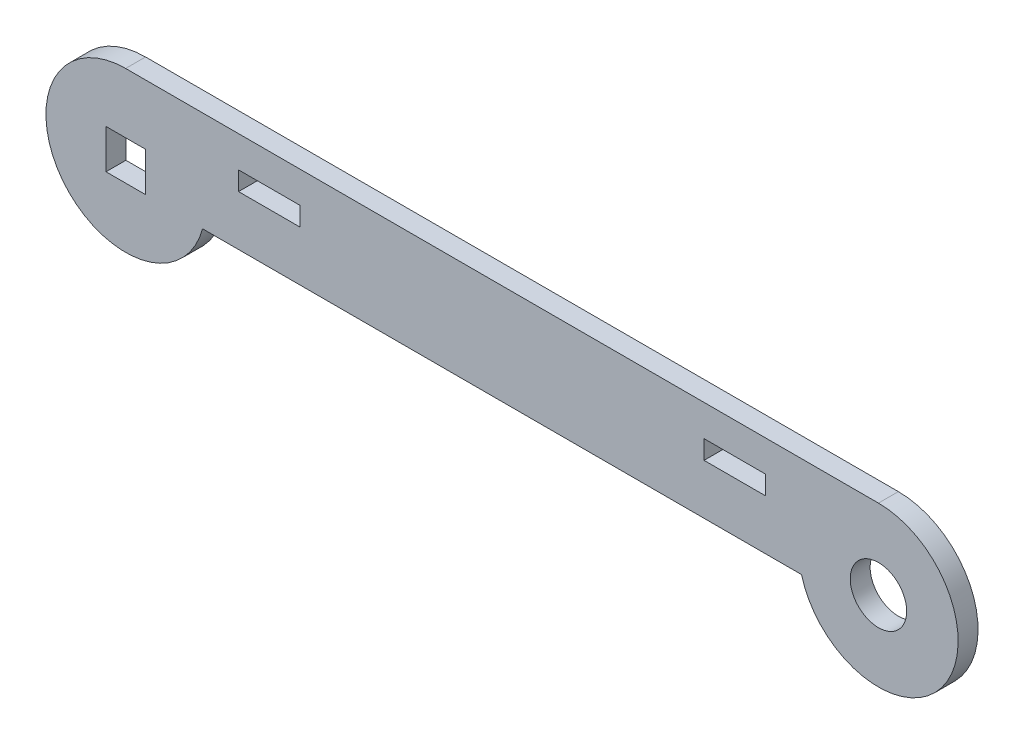
from build123d import *

# Parameters (mm, degrees)
SKETCH1_W           = 4.9
SKETCH1_H           = 1.5
SKETCH1_R           = 6.35
SKETCH1_W_2         = 3.13
SKETCH1_H_2         = 3.13
SKETCH1_R_2         = 2.25
BOSS_EXTRUDE1_DEPTH = 1.5875


with BuildPart() as part:
    # Sketch1 → Boss-Extrude1 (new body)
    # profile 1 of 3: a face of its own
    with BuildSketch(Plane.XY):
        with BuildLine():
            Line((60, 6.35), (0, 6.35))
            ThreePointArc((0, 6.35), (4.490128061, 4.490128061), (6.35, 0))
            ThreePointArc((6.35, 0), (6.295234812, -0.83217706), (6.131883887, -1.65))
            Line((6.131883887, -1.65), (53.868116113, -1.65))
            ThreePointArc((53.868116113, -1.65), (54.960158733, 3.862965182), (60, 6.35))
        make_face()
        with Locations((11.45, 3.1)):
            Rectangle(SKETCH1_W, SKETCH1_H, mode=Mode.SUBTRACT)
        with Locations((48.55, 3.1)):
            Rectangle(SKETCH1_W, SKETCH1_H, mode=Mode.SUBTRACT)
    # profile 2 of 3: a face of its own
    with BuildSketch(Plane.XY):
        Circle(SKETCH1_R)
        Rectangle(SKETCH1_W_2, SKETCH1_H_2, mode=Mode.SUBTRACT)
    # profile 3 of 3: a face of its own
    with BuildSketch(Plane.XY):
        with Locations((60, 0)):
            Circle(SKETCH1_R)
        with Locations((60, 0)):
            Circle(SKETCH1_R_2, mode=Mode.SUBTRACT)
    extrude(amount=BOSS_EXTRUDE1_DEPTH)


solid = part.part
